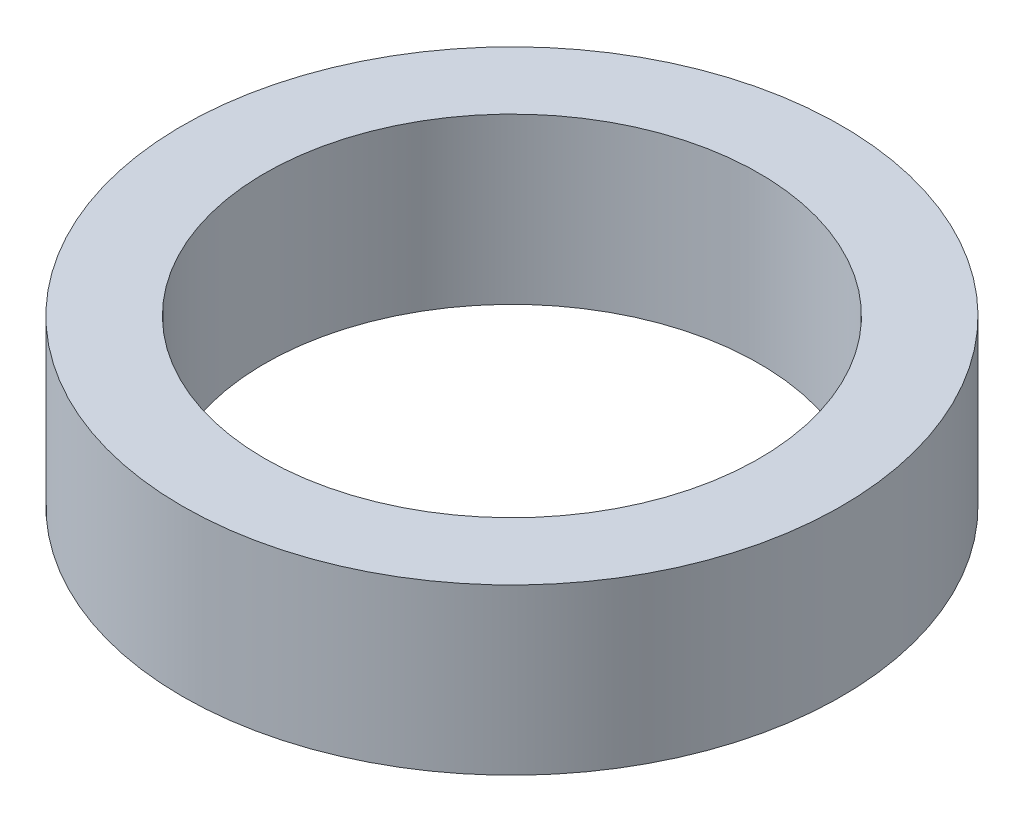
from build123d import *

# Parameters (mm, degrees)
SKETCH1_R           = 20
SKETCH1_R_2         = 15
BOSS_EXTRUDE1_DEPTH = 5


with BuildPart() as part:
    # Sketch1 → Boss-Extrude1 (new, symmetric)
    with BuildSketch(Plane(origin=(0, 0, 0), x_dir=(1, 0, 0), z_dir=(0, 1, 0))):
        with Locations(Location((0, 0, 0), (0, 0, 270))):
            Circle(SKETCH1_R)
        with Locations(Location((0, 0, 0), (0, 0, 270))):
            Circle(SKETCH1_R_2, mode=Mode.SUBTRACT)
    extrude(amount=BOSS_EXTRUDE1_DEPTH, both=True)


solid = part.part
